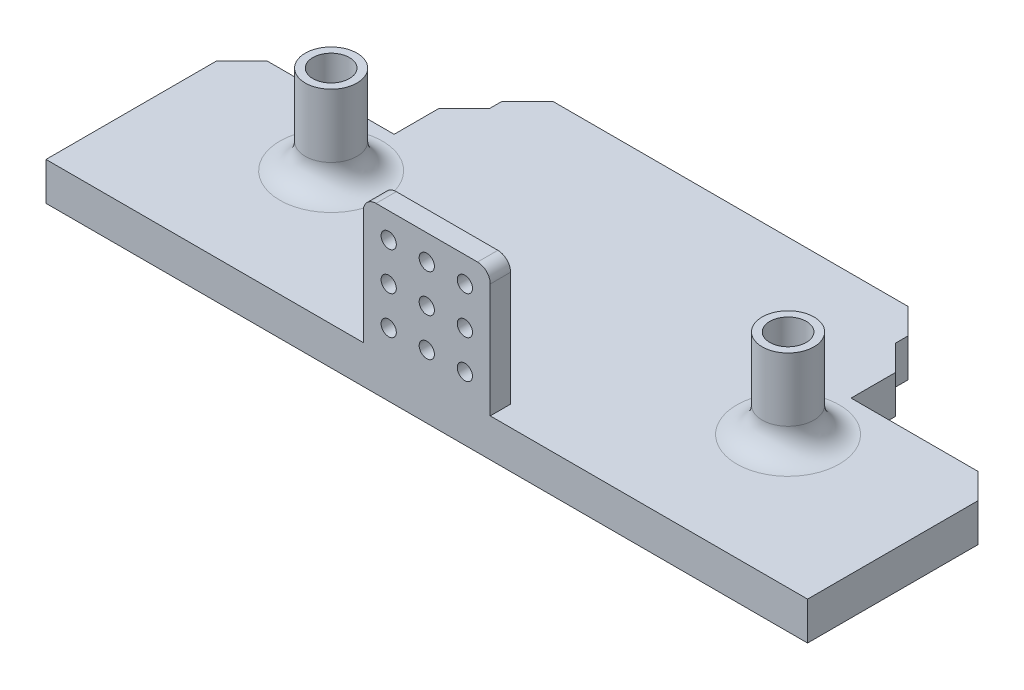
from build123d import *

# Parameters (mm, degrees)
SKETCH1_W           = 150
SKETCH1_H           = 52.32
BOSS_EXTRUDE1_DEPTH = 7.5
SKETCH2_R           = 5.1
BOSS_EXTRUDE2_DEPTH = 17.5
FILLET1_R           = 5
SKETCH3_R           = 3.6
CUT_EXTRUDE1_DEPTH  = 25
SKETCH4_W           = 30
SKETCH4_H           = 7.5
CUT_EXTRUDE2_DEPTH  = 13.75
CHAMFER1_SIZE       = 5
SKETCH5_W           = 80
SKETCH5_H           = 7.5
BOSS_EXTRUDE3_DEPTH = 7.5
CHAMFER2_SIZE       = 5
SKETCH6_R           = 1.5
CUT_EXTRUDE3_DEPTH  = 7.5
SKETCH7_W           = 25
SKETCH7_H           = 4
BOSS_EXTRUDE4_DEPTH = 25
SKETCH8_R           = 1.5
CUT_EXTRUDE4_DEPTH  = 5
FILLET2_R           = 2.5


with BuildPart() as part:
    # Sketch1 → Boss-Extrude1 (new body)
    with BuildSketch(Plane(origin=(0, 0, 0), x_dir=(1, 0, 0), z_dir=(0, 1, 0))):
        Rectangle(SKETCH1_W, SKETCH1_H)
    extrude(amount=BOSS_EXTRUDE1_DEPTH)

    # Sketch2 → Boss-Extrude2 (add)
    with BuildSketch(Plane(origin=(0, 7.5, 0), x_dir=(1, 0, 0), z_dir=(0, 1, 0))):
        with Locations(Location((-45, 0, 0), (0, 0, 270))):
            Circle(SKETCH2_R)
        with Locations(Location((45, 0, 0), (0, 0, 270))):
            Circle(SKETCH2_R)
    extrude(amount=BOSS_EXTRUDE2_DEPTH)

    # Fillet1
    fillet1_edges = [part.edges().sort_by_distance(p)[0] for p in [
        (-45, 7.5, -5.1),
        (45, 7.5, -5.1),
    ]]
    fillet(fillet1_edges, radius=FILLET1_R)

    # Sketch3 → Cut-Extrude1 (cut)
    with BuildSketch(Plane(origin=(0, 25, 0), x_dir=(1, 0, 0), z_dir=(0, 1, 0))):
        with Locations(Location((-45, 0, 0), (0, 0, 270))):
            Circle(SKETCH3_R)
        with Locations(Location((45, 0, 0), (0, 0, 270))):
            Circle(SKETCH3_R)
    extrude(amount=-CUT_EXTRUDE1_DEPTH, mode=Mode.SUBTRACT)

    # Sketch4 → Cut-Extrude2 (cut)
    with BuildSketch(Plane(origin=(0, 0, -26.16), x_dir=(-1, 0, 0), z_dir=(0, 0, -1))):
        with Locations((-60, 3.75)):
            Rectangle(SKETCH4_W, SKETCH4_H)
        with Locations((60, 3.75)):
            Rectangle(SKETCH4_W, SKETCH4_H)
    extrude(amount=-CUT_EXTRUDE2_DEPTH, mode=Mode.SUBTRACT)

    # Chamfer1
    chamfer1_edges = [part.edges().sort_by_distance(p)[0] for p in [
        (75, 3.75, -12.41),
        (45, 3.75, -26.16),
        (-75, 3.75, -12.41),
        (-45, 3.75, -26.16),
    ]]
    chamfer(chamfer1_edges, length=CHAMFER1_SIZE)

    # Sketch5 → Boss-Extrude3 (add)
    with BuildSketch(Plane(origin=(0, 0, -26.16), x_dir=(-1, 0, 0), z_dir=(0, 0, -1))):
        with Locations((0, 3.75)):
            Rectangle(SKETCH5_W, SKETCH5_H)
    extrude(amount=BOSS_EXTRUDE3_DEPTH)

    # Chamfer2
    chamfer2_edges = [part.edges().sort_by_distance(p)[0] for p in [
        (40, 3.75, -33.66),
        (-40, 3.75, -33.66),
    ]]
    chamfer(chamfer2_edges, length=CHAMFER2_SIZE)

    # Sketch6 → Cut-Extrude3 (cut)
    with BuildSketch(Plane(origin=(0, 0, -33.66), x_dir=(-1, 0, 0), z_dir=(0, 0, -1))):
        with Locations((-15, 3.75)):
            Circle(SKETCH6_R)
        with Locations((15, 3.75)):
            Circle(SKETCH6_R)
    extrude(amount=-CUT_EXTRUDE3_DEPTH, mode=Mode.SUBTRACT)

    # Sketch7 → Boss-Extrude4 (add)
    with BuildSketch(Plane(origin=(0, 7.5, 0), x_dir=(1, 0, 0), z_dir=(0, 1, 0))):
        with Locations((0, -24.16)):
            Rectangle(SKETCH7_W, SKETCH7_H)
    extrude(amount=BOSS_EXTRUDE4_DEPTH)

    # Sketch8 → Cut-Extrude4 (cut)
    with BuildSketch(Plane(origin=(0, 0, 22.16), x_dir=(-1, 0, 0), z_dir=(0, 0, -1))):
        with Locations((-7.5, 20)):
            Circle(SKETCH8_R)
        with Locations((0, 20)):
            Circle(SKETCH8_R)
        with Locations((-7.5, 27.5)):
            Circle(SKETCH8_R)
        with Locations((0, 27.5)):
            Circle(SKETCH8_R)
        with Locations((7.5, 27.5)):
            Circle(SKETCH8_R)
        with Locations((7.5, 20)):
            Circle(SKETCH8_R)
        with Locations((-7.5, 12.5)):
            Circle(SKETCH8_R)
        with Locations((0, 12.5)):
            Circle(SKETCH8_R)
        with Locations((7.5, 12.5)):
            Circle(SKETCH8_R)
    extrude(amount=-CUT_EXTRUDE4_DEPTH, mode=Mode.SUBTRACT)

    # Fillet2
    fillet2_edges = [part.edges().sort_by_distance(p)[0] for p in [
        (-12.5, 32.5, 24.16),
        (12.5, 32.5, 24.16),
    ]]
    fillet(fillet2_edges, radius=FILLET2_R)


solid = part.part
